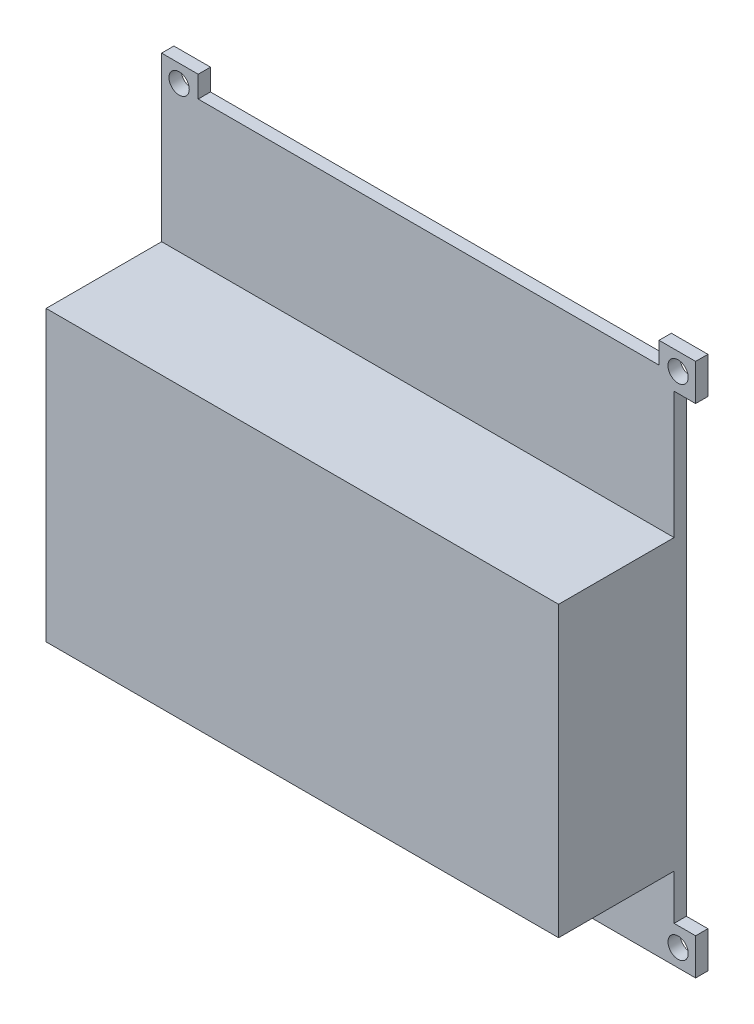
from build123d import *

# Parameters (mm, degrees)
SKETCH1_W               = 86.9
SKETCH1_H               = 86.9
BOSS_EXTRUDE1_DEPTH     = 2
SKETCH2_R               = 1.65
CUT_EXTRUDE3_DEPTH      = 123.911431527
SKETCH5_W               = 86.9
SKETCH5_H               = 47
BOSS_EXTRUDE3_DEPTH     = 18.8
CUT_EXTRUDE5_START      = -2
SKETCH6_W               = 73.78
SKETCH6_H               = 16.8
CUT_EXTRUDE5_DEPTH      = 43
CUT_EXTRUDE7_DEPTH      = 125.324816509
CUT_EXTRUDE7_DEPTH_BACK = 125.324816509
SKETCH8_W               = 3.5
SKETCH8_H               = 75
SKETCH8_W_2             = 75
SKETCH8_H_2             = 3.5


with BuildPart() as part:
    # Sketch1 → Boss-Extrude1 (new body)
    with BuildSketch(Plane(origin=(0, 0, 0), x_dir=(0, 1, 0), z_dir=(0, 0, 1))):
        with Locations((43.45, 43.45)):
            Rectangle(SKETCH1_W, SKETCH1_H)
    extrude(amount=BOSS_EXTRUDE1_DEPTH)

    # Sketch2 → Cut-Extrude3 (cut, through all)
    with BuildSketch(Plane.XY.offset(2)):
        with Locations((-84.05, 2.85)):
            Circle(SKETCH2_R)
        with Locations((-2.85, 2.85)):
            Circle(SKETCH2_R)
        with Locations((-2.85, 84.05)):
            Circle(SKETCH2_R)
        with Locations((-84.05, 84.05)):
            Circle(SKETCH2_R)
    extrude(amount=-CUT_EXTRUDE3_DEPTH, mode=Mode.SUBTRACT)

    # Sketch5 → Boss-Extrude3 (add)
    with BuildSketch(Plane.XY.offset(2)):
        with Locations((-43.45, 36.82)):
            Rectangle(SKETCH5_W, SKETCH5_H)
    extrude(amount=BOSS_EXTRUDE3_DEPTH)

    # Sketch6 → Cut-Extrude5 (cut)
    with BuildSketch(Plane.XZ.offset(-13.32).offset(CUT_EXTRUDE5_START)):
        with Locations((-50.01, 10.4)):
            Rectangle(SKETCH6_W, SKETCH6_H)
    extrude(amount=-CUT_EXTRUDE5_DEPTH, mode=Mode.SUBTRACT)

    # Sketch8 → Cut-Extrude7 (cut, two sides: drawn at the far end of the back side and taken through both)
    with BuildSketch(Plane.XY.offset(2).offset(-CUT_EXTRUDE7_DEPTH_BACK)):
        with Locations((-1.75, 43.45)):
            Rectangle(SKETCH8_W, SKETCH8_H)
        with Locations((-43.45, 85.15)):
            Rectangle(SKETCH8_W_2, SKETCH8_H_2)
    extrude(amount=CUT_EXTRUDE7_DEPTH + CUT_EXTRUDE7_DEPTH_BACK, mode=Mode.SUBTRACT)


solid = part.part
